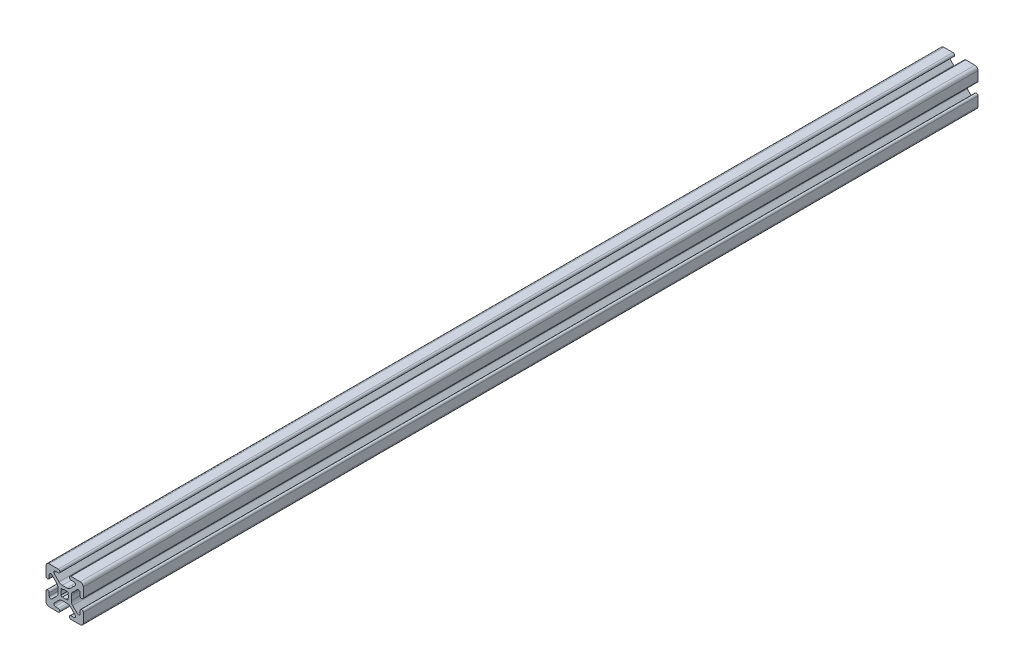
from build123d import *

# Parameters (mm, degrees)
BOSS_EXTRUDE1_DEPTH = 609.6


with BuildPart() as part:
    # Sketch1 → Boss-Extrude1 (new body)
    with BuildSketch(Plane.XY.offset(304.8)):
        with BuildLine():
            Line((-12.7, -4.356099789), (-12.7, -10.5918))
            ThreePointArc((-12.7, -10.5918), (-12.082522516, -12.082522516), (-10.5918, -12.7))
            Line((-10.5918, -12.7), (-4.3561, -12.7))
            ThreePointArc((-4.3561, -12.7), (-3.2512, -11.5951), (-4.3561, -10.4902))
            Line((-4.3561, -10.4902), (-6.370083784, -10.4902))
            ThreePointArc((-6.370083784, -10.4902), (-7.348856741, -9.836204819), (-7.119204173, -8.681663396))
            Line((-7.119204173, -8.681663396), (-3.884643889, -5.447103112))
            ThreePointArc((-3.884643889, -5.447103112), (-2.854599756, -4.758849626), (-1.639579858, -4.517167142))
            Line((-1.639579858, -4.517167142), (1.639579858, -4.517167142))
            ThreePointArc((1.639579858, -4.517167142), (2.854599756, -4.758849626), (3.884643889, -5.447103112))
            Line((3.884643889, -5.447103112), (7.119204173, -8.681663397))
            ThreePointArc((7.119204173, -8.681663397), (7.348856741, -9.836204819), (6.370083784, -10.4902))
            Line((6.370083784, -10.4902), (4.356099789, -10.4902))
            ThreePointArc((4.356099789, -10.4902), (3.251199789, -11.5951), (4.356099789, -12.7))
            Line((4.356099789, -12.7), (10.5918, -12.7))
            ThreePointArc((10.5918, -12.7), (12.082522516, -12.082522516), (12.7, -10.5918))
            Line((12.7, -10.5918), (12.7, -4.356100001))
            ThreePointArc((12.7, -4.356100001), (11.5951, -3.251200001), (10.490200001, -4.356100001))
            Line((10.490200001, -4.356100001), (10.490200001, -6.370083785))
            ThreePointArc((10.490200001, -6.370083785), (9.836204819, -7.348856741), (8.681663397, -7.119204174))
            Line((8.681663397, -7.119204174), (5.447103112, -3.884643889))
            ThreePointArc((5.447103112, -3.884643889), (4.758849627, -2.854599757), (4.517167143, -1.639579859))
            Line((4.517167143, -1.639579859), (4.517167143, 1.639579859))
            ThreePointArc((4.517167143, 1.639579859), (4.758849627, 2.854599757), (5.447103112, 3.884643889))
            Line((5.447103112, 3.884643889), (8.681663397, 7.119204174))
            ThreePointArc((8.681663397, 7.119204174), (9.836204819, 7.348856741), (10.490200001, 6.370083784))
            Line((10.490200001, 6.370083784), (10.490200001, 4.356099789))
            ThreePointArc((10.490200001, 4.356099789), (11.5951, 3.251199789), (12.7, 4.356099789))
            Line((12.7, 4.356099789), (12.7, 10.5918))
            ThreePointArc((12.7, 10.5918), (12.082522516, 12.082522516), (10.5918, 12.7))
            Line((10.5918, 12.7), (4.3561, 12.7))
            ThreePointArc((4.3561, 12.7), (3.2512, 11.5951), (4.3561, 10.4902))
            Line((4.3561, 10.4902), (6.370083784, 10.4902))
            ThreePointArc((6.370083784, 10.4902), (7.348856741, 9.836204819), (7.119204173, 8.681663397))
            Line((7.119204173, 8.681663397), (3.884643889, 5.447103112))
            ThreePointArc((3.884643889, 5.447103112), (2.854599756, 4.758849626), (1.639579858, 4.517167142))
            Line((1.639579858, 4.517167142), (-1.639579858, 4.517167142))
            ThreePointArc((-1.639579858, 4.517167142), (-2.854599756, 4.758849626), (-3.884643889, 5.447103112))
            Line((-3.884643889, 5.447103112), (-7.119204173, 8.681663396))
            ThreePointArc((-7.119204173, 8.681663396), (-7.348856741, 9.836204819), (-6.370083784, 10.4902))
            Line((-6.370083784, 10.4902), (-4.356099789, 10.4902))
            ThreePointArc((-4.356099789, 10.4902), (-3.251199789, 11.5951), (-4.356099789, 12.7))
            Line((-4.356099789, 12.7), (-10.5918, 12.7))
            ThreePointArc((-10.5918, 12.7), (-12.082522516, 12.082522516), (-12.7, 10.5918))
            Line((-12.7, 10.5918), (-12.7, 4.3561))
            ThreePointArc((-12.7, 4.3561), (-11.5951, 3.2512), (-10.4902, 4.3561))
            Line((-10.4902, 4.3561), (-10.4902, 6.370083784))
            ThreePointArc((-10.4902, 6.370083784), (-9.836204819, 7.348856741), (-8.681663396, 7.119204173))
            Line((-8.681663396, 7.119204173), (-5.447103112, 3.884643889))
            ThreePointArc((-5.447103112, 3.884643889), (-4.758849626, 2.854599756), (-4.517167142, 1.639579858))
            Line((-4.517167142, 1.639579858), (-4.517167142, -1.639579858))
            ThreePointArc((-4.517167142, -1.639579858), (-4.758849626, -2.854599756), (-5.447103112, -3.884643889))
            Line((-5.447103112, -3.884643889), (-8.681663396, -7.119204173))
            ThreePointArc((-8.681663396, -7.119204173), (-9.836204819, -7.348856741), (-10.4902, -6.370083784))
            Line((-10.4902, -6.370083784), (-10.4902, -4.356099789))
            ThreePointArc((-10.4902, -4.356099789), (-11.5951, -3.251199789), (-12.7, -4.356099789))
        make_face()
        with BuildLine():
            ThreePointArc((-2.231856263, 1.340533428), (-2.289965312, 2.289965312), (-1.340533428, 2.231856263))
            ThreePointArc((-1.340533428, 2.231856263), (0, 2.6035), (1.340533428, 2.231856263))
            ThreePointArc((1.340533428, 2.231856263), (2.289965312, 2.289965312), (2.231856263, 1.340533428))
            ThreePointArc((2.231856263, 1.340533428), (2.6035, 0), (2.231856263, -1.340533428))
            ThreePointArc((2.231856263, -1.340533428), (2.289965312, -2.289965312), (1.340533428, -2.231856263))
            ThreePointArc((1.340533428, -2.231856263), (0, -2.6035), (-1.340533428, -2.231856263))
            ThreePointArc((-1.340533428, -2.231856263), (-2.289965312, -2.289965312), (-2.231856263, -1.340533428))
            ThreePointArc((-2.231856263, -1.340533428), (-2.6035, 0), (-2.231856263, 1.340533428))
        make_face(mode=Mode.SUBTRACT)
    extrude(amount=-BOSS_EXTRUDE1_DEPTH)


solid = part.part
